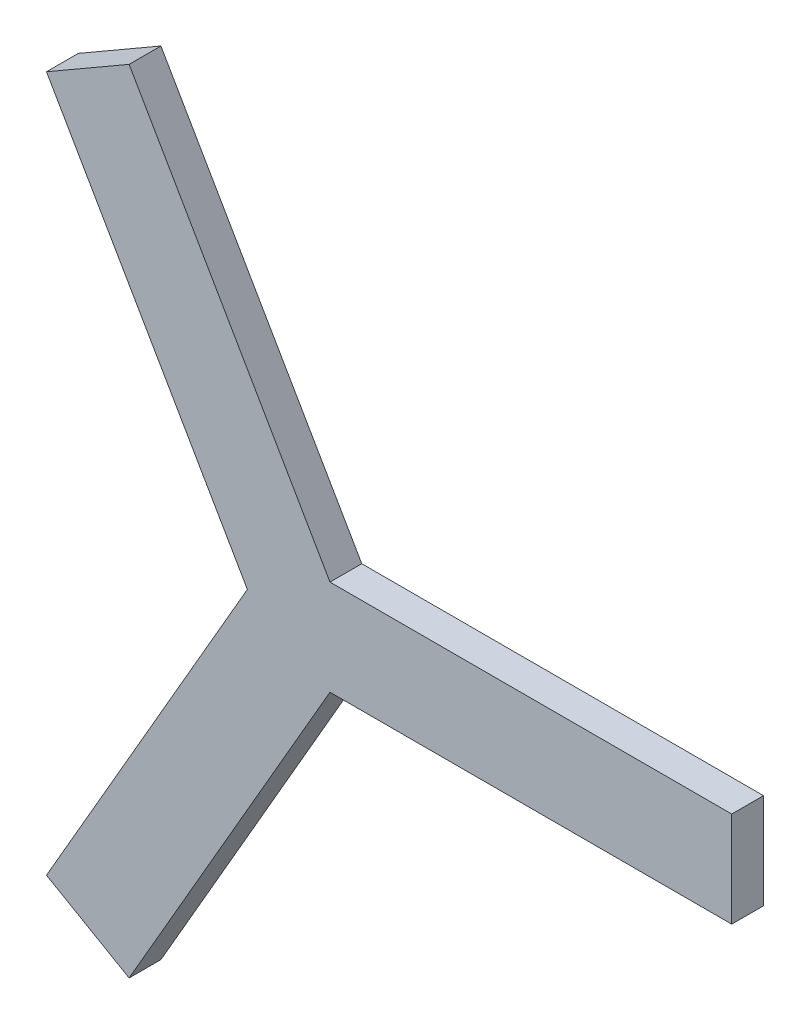
from build123d import *

# Parameters (mm, degrees)
BOSS_EXTRUDE2_DEPTH = 20


with BuildPart() as part:
    # Sketch1 → Boss-Extrude2 (new body)
    with BuildSketch(Plane.XY):
        Polygon((270, 30), (17.320508076, 30), (-109.019237886, 248.826859022), (-160.980762114, 218.826859022), (-34.641016151, 0), (-160.980762114, -218.826859022), (-109.019237886, -248.826859022), (17.320508076, -30), (270, -30), align=None)
    extrude(amount=BOSS_EXTRUDE2_DEPTH)


solid = part.part
